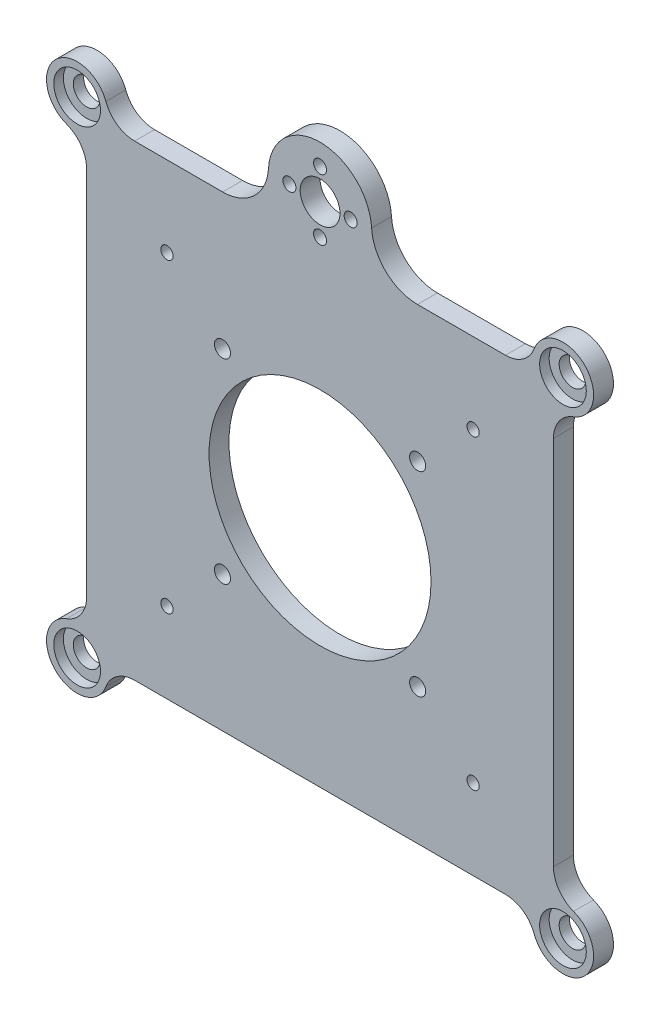
from build123d import *

# Parameters (mm, degrees)
EXTRUDE_1_DEPTH     = 5.2
SKETCH_2_R          = 6.1
CUT_EXTRUDE_1_DEPTH = 2.5
SKETCH_3_R          = 5.2
CUT_EXTRUDE_2_DEPTH = 6
SKETCH_4_R          = 1.7
CUT_EXTRUDE_3_DEPTH = 6
SKETCH_5_R          = 1.6
SKETCH_5_R_2        = 2.1
CUT_EXTRUDE_4_DEPTH = 6
SKETCH_6_R          = 29
CUT_EXTRUDE_5_DEPTH = 6
SKETCH_7_R          = 3.5
CUT_EXTRUDE_6_DEPTH = 10


with BuildPart() as part:
    # 草图1 → 凸台-拉伸1 (new body)
    with BuildSketch(Plane.XY):
        with BuildLine():
            Line((-48.459116019, -61), (48.459116019, -61))
            ThreePointArc((48.459116019, -61), (53.03620543, -62.438730875), (55.966994877, -66.237436867))
            ThreePointArc((55.966994877, -66.237436867), (69.131727984, -69.131727984), (66.237436867, -55.966994877))
            ThreePointArc((66.237436867, -55.966994877), (62.438730875, -53.03620543), (61, -48.459116019))
            Line((61, -48.459116019), (61, 48.459116019))
            ThreePointArc((61, 48.459116019), (62.438730875, 53.03620543), (66.237436867, 55.966994877))
            ThreePointArc((66.237436867, 55.966994877), (69.131727984, 69.131727984), (55.966994877, 66.237436867))
            ThreePointArc((55.966994877, 66.237436867), (53.03620543, 62.438730875), (48.459116019, 61))
            Line((48.459116019, 61), (25.455844123, 61))
            ThreePointArc((25.455844123, 61), (17.223912036, 64.268717499), (13.476623359, 72.294117647))
            ThreePointArc((13.476623359, 72.294117647), (0, 85), (-13.476623359, 72.294117647))
            ThreePointArc((-13.476623359, 72.294117647), (-17.223912036, 64.268717499), (-25.455844123, 61))
            Line((-25.455844123, 61), (-48.459116019, 61))
            ThreePointArc((-48.459116019, 61), (-53.03620543, 62.438730875), (-55.966994877, 66.237436867))
            ThreePointArc((-55.966994877, 66.237436867), (-69.131727984, 69.131727984), (-66.237436867, 55.966994877))
            ThreePointArc((-66.237436867, 55.966994877), (-62.438730875, 53.03620543), (-61, 48.459116019))
            Line((-61, 48.459116019), (-61, -48.459116019))
            ThreePointArc((-61, -48.459116019), (-62.438730875, -53.03620543), (-66.237436867, -55.966994877))
            ThreePointArc((-66.237436867, -55.966994877), (-69.131727984, -69.131727984), (-55.966994877, -66.237436867))
            ThreePointArc((-55.966994877, -66.237436867), (-53.03620543, -62.438730875), (-48.459116019, -61))
        make_face()
    extrude(amount=EXTRUDE_1_DEPTH)

    # 草图2 → 切除-拉伸1 (cut)
    with BuildSketch(Plane.XY.offset(5.2)):
        with Locations((-63.474873734, 63.474873734)):
            Circle(SKETCH_2_R)
        with Locations((63.474873734, 63.474873734)):
            Circle(SKETCH_2_R)
        with Locations((63.474873734, -63.474873734)):
            Circle(SKETCH_2_R)
        with Locations((-63.474873734, -63.474873734)):
            Circle(SKETCH_2_R)
    extrude(amount=-CUT_EXTRUDE_1_DEPTH, mode=Mode.SUBTRACT)

    # 草图3 → 切除-拉伸2 (cut)
    with BuildSketch(Plane.XY.offset(5.2)):
        with Locations((0, 71.5)):
            Circle(SKETCH_3_R)
    extrude(amount=-CUT_EXTRUDE_2_DEPTH, mode=Mode.SUBTRACT)

    # 草图4 → 切除-拉伸3 (cut)
    with BuildSketch(Plane.XY.offset(5.2)):
        with Locations((8, 71.5)):
            Circle(SKETCH_4_R)
        with Locations((0, 79.5)):
            Circle(SKETCH_4_R)
        with Locations((-8, 71.5)):
            Circle(SKETCH_4_R)
        with Locations((0, 63.5)):
            Circle(SKETCH_4_R)
    extrude(amount=-CUT_EXTRUDE_3_DEPTH, mode=Mode.SUBTRACT)

    # 草图5 → 切除-拉伸4 (cut)
    with BuildSketch(Plane.XY.offset(5.2)):
        with Locations((-40, 40)):
            Circle(SKETCH_5_R)
        with Locations((40, 40)):
            Circle(SKETCH_5_R)
        with Locations((40, -40)):
            Circle(SKETCH_5_R)
        with Locations((-40, -40)):
            Circle(SKETCH_5_R)
        with Locations((-25.5, 25.5)):
            Circle(SKETCH_5_R_2)
        with Locations((25.5, 25.5)):
            Circle(SKETCH_5_R_2)
        with Locations((25.5, -25.5)):
            Circle(SKETCH_5_R_2)
        with Locations((-25.5, -25.5)):
            Circle(SKETCH_5_R_2)
    extrude(amount=-CUT_EXTRUDE_4_DEPTH, mode=Mode.SUBTRACT)

    # 草图6 → 切除-拉伸5 (cut)
    with BuildSketch(Plane.XY.offset(5.2)):
        Circle(SKETCH_6_R)
    extrude(amount=-CUT_EXTRUDE_5_DEPTH, mode=Mode.SUBTRACT)

    # 草图7 → 切除-拉伸6 (cut)
    with BuildSketch(Plane.XY.offset(2.7)):
        with Locations((-63.474873734, 63.474873734)):
            Circle(SKETCH_7_R)
        with Locations((63.474873734, 63.474873734)):
            Circle(SKETCH_7_R)
        with Locations((-63.474873734, -63.474873734)):
            Circle(SKETCH_7_R)
        with Locations((63.474873734, -63.474873734)):
            Circle(SKETCH_7_R)
    extrude(amount=-CUT_EXTRUDE_6_DEPTH, mode=Mode.SUBTRACT)


solid = part.part
